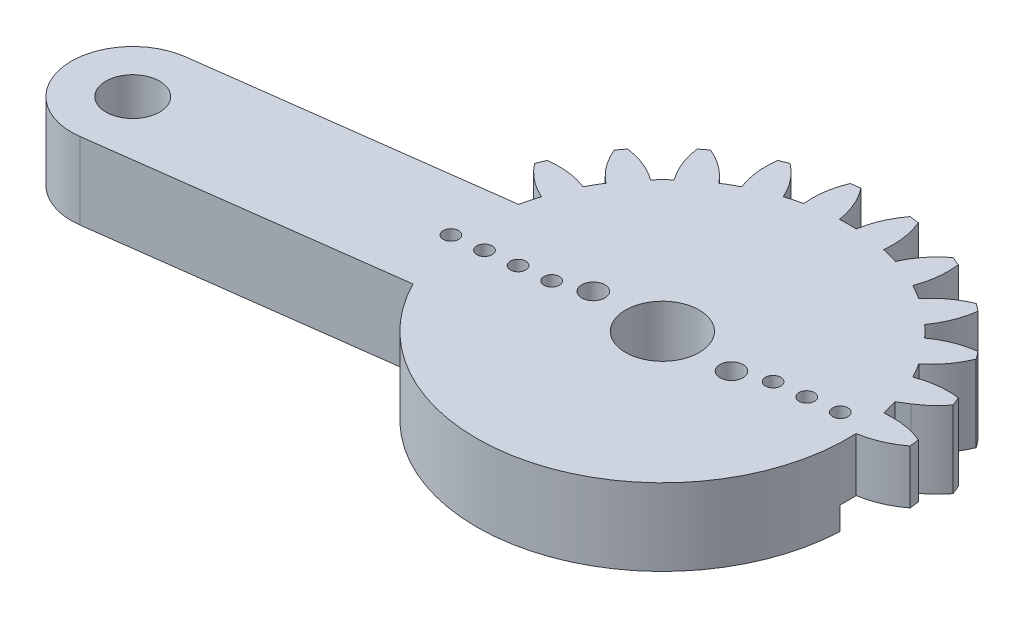
from build123d import *

# Parameters (mm, degrees)
SKETCH1_R           = 1.75
SKETCH1_R_2         = 2.4
SKETCH1_R_3         = 0.75
BOSS_EXTRUDE1_DEPTH = 5
SKETCH2_R           = 0.500000007
SKETCH2_R_2         = 2.25
CUT_EXTRUDE1_DEPTH  = 48.168776066
CUT_EXTRUDE2_DEPTH  = 1.5


with BuildPart() as part:
    # Sketch1 → Boss-Extrude1 (new body)
    with BuildSketch(Plane(origin=(0, 4, 0), x_dir=(1, 0, 0), z_dir=(0, 1, 0))):
        with BuildLine():
            Line((1.43808022, 3.600125745), (2.081641936, 4))
            ThreePointArc((2.081641936, 4), (2.861028333, 4.588201733), (3.521749436, 5.30713988))
            ThreePointArc((3.521749436, 5.30713988), (3.405395609, 5.596745198), (3.282888305, 5.883801663))
            ThreePointArc((3.282888305, 5.883801663), (1.93527598, 5.894040025), (0.627094961, 5.57027124))
            ThreePointArc((0.627094961, 5.57027124), (0.366286148, 6.046375), (0.084372603, 6.510293938))
            ThreePointArc((0.084372603, 6.510293938), (1.018855105, 7.48132754), (1.683794586, 8.65351323))
            ThreePointArc((1.683794586, 8.65351323), (1.496450048, 8.903135899), (1.303821399, 9.148703928))
            ThreePointArc((1.303821399, 9.148703928), (-0.000522033, 8.809805691), (-1.180330337, 8.158486898))
            ThreePointArc((-1.180330337, 8.158486898), (-1.555477026, 8.550865528), (-1.947855656, 8.926012217))
            ThreePointArc((-1.947855656, 8.926012217), (-1.296536862, 10.105820521), (-0.957638625, 11.410163953))
            ThreePointArc((-0.957638625, 11.410163953), (-1.203206655, 11.602792602), (-1.452829324, 11.79013714))
            ThreePointArc((-1.452829324, 11.79013714), (-2.625015014, 11.125197659), (-3.596048616, 10.190715157))
            ThreePointArc((-3.596048616, 10.190715157), (-4.059967554, 10.472628702), (-4.536071314, 10.733437515))
            ThreePointArc((-4.536071314, 10.733437515), (-4.212302529, 12.041618533), (-4.222540891, 13.389230859))
            ThreePointArc((-4.222540891, 13.389230859), (-4.509597355, 13.511738163), (-4.799202674, 13.62809199))
            ThreePointArc((-4.799202674, 13.62809199), (-5.759348103, 12.682425791), (-6.455432668, 11.528463019))
            ThreePointArc((-6.455432668, 11.528463019), (-6.976508546, 11.680699536), (-7.503891752, 11.809396783))
            ThreePointArc((-7.503891752, 11.809396783), (-7.529737283, 13.156800143), (-7.888414517, 14.455843809))
            ThreePointArc((-7.888414517, 14.455843809), (-8.197396993, 14.499881098), (-8.507248835, 14.537314892))
            ThreePointArc((-8.507248835, 14.537314892), (-9.18992168, 13.375367565), (-9.563620196, 12.080565177))
            ThreePointArc((-9.563620196, 12.080565177), (-10.106342554, 12.09275), (-10.649064912, 12.080565177))
            ThreePointArc((-10.649064912, 12.080565177), (-11.022763428, 13.375367565), (-11.705436272, 14.537314892))
            ThreePointArc((-11.705436272, 14.537314892), (-12.015288115, 14.499881098), (-12.324270591, 14.455843809))
            ThreePointArc((-12.324270591, 14.455843809), (-12.682947825, 13.156800143), (-12.708793355, 11.809396783))
            ThreePointArc((-12.708793355, 11.809396783), (-13.236176561, 11.680699536), (-13.757252439, 11.528463019))
            ThreePointArc((-13.757252439, 11.528463019), (-14.453337005, 12.682425791), (-15.413482434, 13.62809199))
            ThreePointArc((-15.413482434, 13.62809199), (-15.703087752, 13.511738163), (-15.990144217, 13.389230859))
            ThreePointArc((-15.990144217, 13.389230859), (-16.000382579, 12.041618533), (-15.676613793, 10.733437515))
            ThreePointArc((-15.676613793, 10.733437515), (-16.152717554, 10.472628702), (-16.616636492, 10.190715157))
            ThreePointArc((-16.616636492, 10.190715157), (-17.587670094, 11.125197659), (-18.759855783, 11.79013714))
            ThreePointArc((-18.759855783, 11.79013714), (-19.009478453, 11.602792602), (-19.255046482, 11.410163953))
            ThreePointArc((-19.255046482, 11.410163953), (-18.916148245, 10.105820521), (-18.264829452, 8.926012217))
            ThreePointArc((-18.264829452, 8.926012217), (-18.657208082, 8.550865528), (-19.032354771, 8.158486898))
            ThreePointArc((-19.032354771, 8.158486898), (-20.212163074, 8.809805691), (-21.516506507, 9.148703928))
            ThreePointArc((-21.516506507, 9.148703928), (-21.709135156, 8.903135899), (-21.896479694, 8.65351323))
            ThreePointArc((-21.896479694, 8.65351323), (-21.231540213, 7.48132754), (-20.297057711, 6.510293938))
            ThreePointArc((-20.297057711, 6.510293938), (-20.578971255, 6.046375), (-20.839780068, 5.57027124))
            ThreePointArc((-20.839780068, 5.57027124), (-22.147961087, 5.894040025), (-23.495573413, 5.883801663))
            ThreePointArc((-23.495573413, 5.883801663), (-23.618080717, 5.596745198), (-23.734434544, 5.30713988))
            ThreePointArc((-23.734434544, 5.30713988), (-22.788768345, 4.346994451), (-21.634805572, 3.650909885))
            ThreePointArc((-21.634805572, 3.650909885), (-21.803584999, 3.067429176), (-21.942853375, 2.47620963))
            Line((-21.942853375, 2.47620963), (-41.11537681, -0.047900965))
            ThreePointArc((-41.11537681, -0.047900965), (-44.559051487, -4.53578518), (-40.071167272, -7.979459856))
            Line((-40.071167272, -7.979459856), (-20.898643838, -5.455349261))
            ThreePointArc((-20.898643838, -5.455349261), (-7.038913378, -11.697242445), (1.974222624, 0.542722358))
            ThreePointArc((1.974222624, 0.542722358), (3.269025011, 0.916420874), (4.430972339, 1.599093719))
            ThreePointArc((4.430972339, 1.599093719), (4.393538544, 1.908945561), (4.349501255, 2.217928037))
            ThreePointArc((4.349501255, 2.217928037), (3.050457589, 2.576605271), (1.70305423, 2.602450802))
            ThreePointArc((1.70305423, 2.602450802), (1.581217534, 3.104116905), (1.43808022, 3.600125745))
        make_face()
        with Locations(Location((-40.593272041, -4.013680411, 0), (0, 0, 90))):
            Circle(SKETCH1_R, mode=Mode.SUBTRACT)
        with Locations(Location((-10.106342554, 0, 0), (0, 0, 90))):
            Circle(SKETCH1_R_2, mode=Mode.SUBTRACT)
        with Locations(Location((-5.606342554, 0, 0), (0, 0, 90))):
            Circle(SKETCH1_R_3, mode=Mode.SUBTRACT)
        with Locations(Location((-14.606342554, 0, 0), (0, 0, 90))):
            Circle(SKETCH1_R_3, mode=Mode.SUBTRACT)
    extrude(amount=-BOSS_EXTRUDE1_DEPTH)

    # Sketch2 → Cut-Extrude1 (cut, through all)
    with BuildSketch(Plane.XZ.offset(1)):
        with Locations(Location((-22.425502423, 1.456820148, 0), (0, 0, 270))):
            Circle(SKETCH2_R)
        with Locations(Location((-16.556398443, 0.76276073, 0), (0, 0, 270))):
            Circle(SKETCH2_R)
        with Locations(Location((-20.469134429, 1.225467009, 0), (0, 0, 270))):
            Circle(SKETCH2_R)
        with Locations(Location((-18.512766436, 0.994113869, 0), (0, 0, 270))):
            Circle(SKETCH2_R)
        with Locations(Location((-3.656286665, -0.76276073, 0), (0, 0, 270))):
            Circle(SKETCH2_R)
        with Locations(Location((-1.699918672, -0.994113869, 0), (0, 0, 270))):
            Circle(SKETCH2_R)
        with Locations(Location((0.256449322, -1.225467009, 0), (0, 0, 270))):
            Circle(SKETCH2_R)
        with Locations((-10.106342554, 0)):
            Circle(SKETCH2_R_2)
    extrude(amount=-CUT_EXTRUDE1_DEPTH, mode=Mode.SUBTRACT)

    # Sketch3 → Cut-Extrude2 (cut)
    with BuildSketch(Plane.XZ.offset(1)):
        with BuildLine():
            Line((4.066067931, 0.080576868), (-7.656447881, 2.429097794))
            ThreePointArc((-7.656447881, 2.429097794), (-9.701180965, 3.426126689), (-11.922071261, 2.933535284))
            Line((-11.922071261, 2.933535284), (-23.869034652, 3.384083008))
            ThreePointArc((-23.869034652, 3.384083008), (-25.672874683, 1.840842872), (-24.278753039, -0.080576868))
            Line((-24.278753039, -0.080576868), (-12.556237227, -2.429097794))
            ThreePointArc((-12.556237227, -2.429097794), (-10.511504143, -3.426126689), (-8.290613847, -2.933535284))
            Line((-8.290613847, -2.933535284), (3.656349544, -3.384083008))
            ThreePointArc((3.656349544, -3.384083008), (5.460189575, -1.840842872), (4.066067931, 0.080576868))
        make_face()
    extrude(amount=-CUT_EXTRUDE2_DEPTH, mode=Mode.SUBTRACT)


solid = part.part
